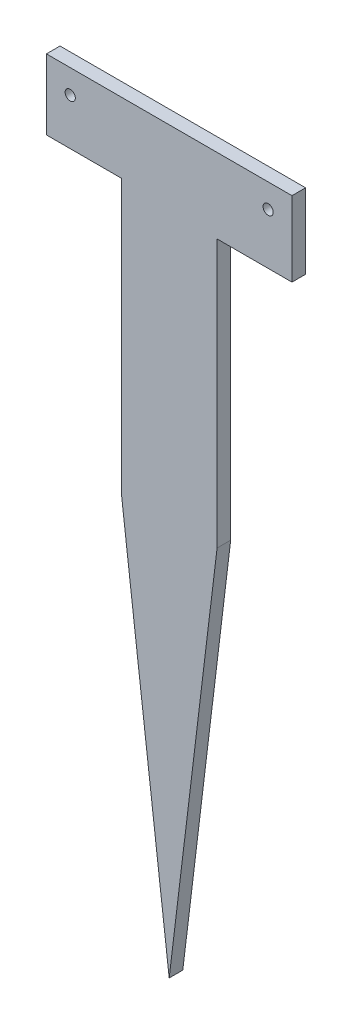
from build123d import *

# Parameters (mm, degrees)
SKETCH_1_R      = 1.5
EXTRUDE_1_DEPTH = 4


with BuildPart() as part:
    # 草图1 → 凸台-拉伸1 (new body)
    with BuildSketch(Plane.XY):
        Polygon((-7, 7), (65.12, 7), (65.12, -15), (43.12, -15), (43.12, -93.617838822), (29.06, -210), (15, -93.617838822), (15, -13.617838822), (-7, -13.617838822), align=None)
        Circle(SKETCH_1_R, mode=Mode.SUBTRACT)
        with Locations((58.12, 0)):
            Circle(SKETCH_1_R, mode=Mode.SUBTRACT)
    extrude(amount=EXTRUDE_1_DEPTH)


solid = part.part
